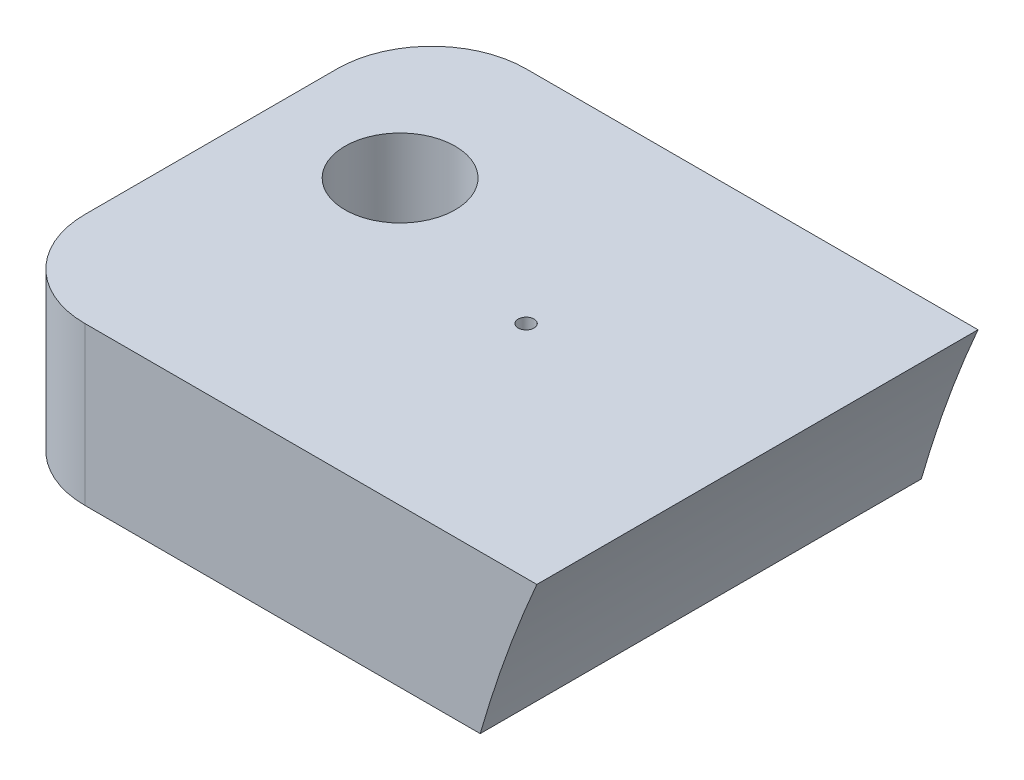
from build123d import *
from build123d.topology import SkipClean

# Parameters (mm, degrees)
SKETCH1_R                      = 40
SKETCH1_R_2                    = 38
BOSS_EXTRUDE1_DEPTH            = 200
SKETCH2_R                      = 40
BOSS_EXTRUDE2_DEPTH            = 2
BOSS_EXTRUDE3_DEPTH            = 107
BOSS_EXTRUDE4_DEPTH            = 2
SKETCH5_R                      = 1.75
CUT_EXTRUDE1_DEPTH             = 225.428162226
CUT_EXTRUDE2_REACH             = 218.296
SKETCH6_R                      = 4
CUT_EXTRUDE2_DIRECTION_2_REACH = 218.296
CIRPATTERN1_COUNT              = 2
CIRPATTERN1_ANGLE              = 90
BOSS_EXTRUDE5_REACH            = 241.742
BOSS_EXTRUDE5_END_RADIUS       = 40
SKETCH7_W                      = 14
SKETCH7_H                      = 5
CUT_EXTRUDE3_REACH             = 221.818
SKETCH8_R                      = 1.75
FILLET1_R                      = 3
CUT_EXTRUDE4_REACH             = 220.598
SKETCH9_R                      = 0.25
BOSS_EXTRUDE6_START            = 2
BOSS_EXTRUDE6_DEPTH            = 2
CUT_EXTRUDE5_REACH             = 220.147


with BuildPart() as part:
    # Sketch1 → Boss-Extrude1 (new body)
    with BuildSketch(Plane.XY):
        Circle(SKETCH1_R)
        Circle(SKETCH1_R_2, mode=Mode.SUBTRACT)
    extrude(amount=BOSS_EXTRUDE1_DEPTH)

    # Sketch2 → Boss-Extrude2 (add)
    with BuildSketch(Plane.XY.offset(180)):
        Circle(SKETCH2_R)
    extrude(amount=BOSS_EXTRUDE2_DEPTH)

    # Sketch3 → Boss-Extrude3 (add)
    with BuildSketch(Plane(origin=(0, 0, 0), x_dir=(-1, 0, 0), z_dir=(0, 0, -1))):
        with BuildLine():
            Line((-24, -32), (-72, -32))
            Line((-72, -32), (-72, -30))
            Line((-72, -30), (-26.457513111, -30))
            ThreePointArc((-26.457513111, -30), (-25.248567431, -31.024342744), (-24, -32))
        make_face()
        with BuildLine():
            Line((-24, 32), (-72, 32))
            Line((-72, 32), (-72, 30))
            Line((-72, 30), (-26.457513111, 30))
            ThreePointArc((-26.457513111, 30), (-25.248567431, 31.024342744), (-24, 32))
        make_face()
    extrude(amount=-BOSS_EXTRUDE3_DEPTH)

    # Sketch4 → Boss-Extrude4 (add)
    with BuildSketch(Plane.XY.offset(107)):
        with BuildLine():
            Line((72, -32), (24, -32))
            ThreePointArc((24, -32), (40, 0), (24, 32))
            Line((24, 32), (72, 32))
            Line((72, 32), (72, -32))
        make_face()
    extrude(amount=BOSS_EXTRUDE4_DEPTH)

    # Sketch5 → Cut-Extrude1 (cut, through all)
    with BuildSketch(Plane(origin=(0, 32, 0), x_dir=(1, 0, 0), z_dir=(0, 1, 0))):
        with Locations(Location((43.5, -102.5, 0), (0, 0, 270))):
            Circle(SKETCH5_R)
        with Locations(Location((43.5, -3.5, 0), (0, 0, 270))):
            Circle(SKETCH5_R)
        with Locations(Location((68.5, -78, 0), (0, 0, 270))):
            Circle(SKETCH5_R)
    extrude(amount=-CUT_EXTRUDE1_DEPTH, mode=Mode.SUBTRACT)

    # Sketch6 → Cut-Extrude2 (cut, up to next)
    with BuildSketch(Plane(origin=(0, 0, 0), x_dir=(0, 0, 1), z_dir=(-0.7071067811865488, 0.7071067811865464, 0)), mode=Mode.PRIVATE) as cut_extrude2_sk1:
        with Locations(Location((187, 0, 0), (0, 0, 90))):
            Circle(SKETCH6_R)
    cut_extrude2_tool1 = extrude(cut_extrude2_sk1.sketch, amount=-CUT_EXTRUDE2_REACH, mode=Mode.PRIVATE) & part.part
    cut_extrude2 = cut_extrude2_tool1.solids().sort_by_distance((0, 0, 187))[0]
    add(cut_extrude2, mode=Mode.SUBTRACT)

    # Sketch6 → Cut-Extrude2 direction 2 (cut, up to next)
    with BuildSketch(Plane(origin=(0, 0, 0), x_dir=(0, 0, 1), z_dir=(-0.7071067811865488, 0.7071067811865464, 0)), mode=Mode.PRIVATE) as cut_extrude2_direction_2_sk1:
        with Locations(Location((187, 0, 0), (0, 0, 90))):
            Circle(SKETCH6_R)
    cut_extrude2_direction_2_tool1 = extrude(cut_extrude2_direction_2_sk1.sketch, amount=CUT_EXTRUDE2_DIRECTION_2_REACH, mode=Mode.PRIVATE) & part.part
    cut_extrude2_direction_2 = cut_extrude2_direction_2_tool1.solids().sort_by_distance((0, 0, 187))[0]
    add(cut_extrude2_direction_2, mode=Mode.SUBTRACT)

    # CirPattern1: Cut-Extrude2, Cut-Extrude2 direction 2 ×2 about axis
    cirpattern1_axis = Axis((0, 0, -12.1), (0, 0, 1))
    add([cut_extrude2.rotate(cirpattern1_axis, i * CIRPATTERN1_ANGLE / (CIRPATTERN1_COUNT - 1)) for i in range(1, CIRPATTERN1_COUNT)], mode=Mode.SUBTRACT)
    add([cut_extrude2_direction_2.rotate(cirpattern1_axis, i * CIRPATTERN1_ANGLE / (CIRPATTERN1_COUNT - 1)) for i in range(1, CIRPATTERN1_COUNT)], mode=Mode.SUBTRACT)

    # Boss-Extrude5: up to this cylinder (the profile starts outside it)
    boss_extrude5_end = Plane(origin=(0, 0, 7), z_dir=(0, 0, -1)) * Cylinder(BOSS_EXTRUDE5_END_RADIUS, 564.484, mode=Mode.PRIVATE)
    # Sketch7 → Boss-Extrude5 (add, up to the surface)
    with BuildSketch(Plane(origin=(-54, 0, 0), x_dir=(0, 0, -1), z_dir=(1, 0, 0)), mode=Mode.PRIVATE) as boss_extrude5_sk1:
        with Locations((-7, -13.5)):
            Rectangle(SKETCH7_W, SKETCH7_H)
    boss_extrude5_tool1 = extrude(boss_extrude5_sk1.sketch, amount=BOSS_EXTRUDE5_REACH, mode=Mode.PRIVATE) - boss_extrude5_end
    add(boss_extrude5_tool1.solids().sort_by_distance((-54, -13.5, 7))[0])
    # Sketch7 → Boss-Extrude5 (add, up to the surface)
    with BuildSketch(Plane(origin=(-54, 0, 0), x_dir=(0, 0, -1), z_dir=(1, 0, 0)), mode=Mode.PRIVATE) as boss_extrude5_sk2:
        with Locations((-7, 13.5)):
            Rectangle(SKETCH7_W, SKETCH7_H)
    boss_extrude5_tool2 = extrude(boss_extrude5_sk2.sketch, amount=BOSS_EXTRUDE5_REACH, mode=Mode.PRIVATE) - boss_extrude5_end
    add(boss_extrude5_tool2.solids().sort_by_distance((-54, 13.5, 7))[0])

    # Cut-Extrude3: up to this face of the body (flat: up to its plane)
    cut_extrude3_end = Plane(part.part.faces().sort_by_distance((-45.33030278, 16, 7))[0])
    # Sketch8 → Cut-Extrude3 (cut, up to the picked face)
    with BuildSketch(Plane.XZ.offset(16), mode=Mode.PRIVATE) as cut_extrude3_sk1:
        with Locations(Location((-50, 5, 0), (0, 0, 270))):
            Circle(SKETCH8_R)
    cut_extrude3_tool1 = split(extrude(cut_extrude3_sk1.sketch, amount=-CUT_EXTRUDE3_REACH, mode=Mode.PRIVATE), bisect_by=cut_extrude3_end, keep=Keep.BOTH, mode=Mode.PRIVATE)
    add(cut_extrude3_tool1.solids().sort_by(Axis((-50, -16, 5), (0, 1, 0)))[0], mode=Mode.SUBTRACT)

    # Fillet1
    fillet1_edges = [part.edges().sort_by_distance(p)[0] for p in [
        (-54, -13.5, 14),
        (-54, -13.5, 0),
        (-54, 13.5, 0),
        (-54, 13.5, 14),
    ]]
    fillet(fillet1_edges, radius=FILLET1_R)

    # Sketch9 → Cut-Extrude4 (cut, up to next)
    with BuildSketch(Plane.XZ.offset(-11), mode=Mode.PRIVATE) as cut_extrude4_sk1:
        with Locations(Location((-44, 7, 0), (0, 0, 270))):
            Circle(SKETCH9_R)
    cut_extrude4_tool1 = extrude(cut_extrude4_sk1.sketch, amount=-CUT_EXTRUDE4_REACH, mode=Mode.PRIVATE) & part.part
    add(cut_extrude4_tool1.solids().sort_by_distance((-44, 11, 7))[0], mode=Mode.SUBTRACT)

    # Sketch10 → Boss-Extrude6 (add)
    with SkipClean():  # the faces are left unmerged after this step: merging them gives an invalid solid
        with BuildSketch(Plane(origin=(0, 0, 0), x_dir=(-1, 0, 0), z_dir=(0, 0, -1)).offset(BOSS_EXTRUDE6_START)):
            with BuildLine():
                ThreePointArc((10, -36.66060556), (0, -38), (-10, -36.66060556))
                Line((-10, -36.66060556), (-10, -38.729833462))
                ThreePointArc((-10, -38.729833462), (0, -40), (10, -38.729833462))
                Line((10, -38.729833462), (10, -36.66060556))
            make_face()
            with BuildLine():
                ThreePointArc((10, 38.729833462), (0, 40), (-10, 38.729833462))
                Line((-10, 38.729833462), (-10, 36.66060556))
                ThreePointArc((-10, 36.66060556), (0, 38), (10, 36.66060556))
                Line((10, 36.66060556), (10, 38.729833462))
            make_face()
        extrude(amount=-BOSS_EXTRUDE6_DEPTH)

    # Sketch11 → Cut-Extrude5 (cut, up to next)
    with BuildSketch(Plane.XY.offset(200), mode=Mode.PRIVATE) as cut_extrude5_sk1:
        with BuildLine():
            ThreePointArc((14.062684519, 37.446507235), (-20.975291487, 34.059318065), (-39.768785027, 4.294617267))
            ThreePointArc((-39.768785027, 4.294617267), (-57.533773757, -120.199175418), (66.76517374, -101.118533584))
            ThreePointArc((66.76517374, -101.118533584), (210.736936915, 32.945452835), (14.062684519, 37.446507235))
        make_face()
    cut_extrude5_tool1 = extrude(cut_extrude5_sk1.sketch, amount=-CUT_EXTRUDE5_REACH, mode=Mode.PRIVATE) & part.part
    add(cut_extrude5_tool1.solids().sort_by_distance((72.535197, -23.225739, 200))[0], mode=Mode.SUBTRACT)


solid = part.part
